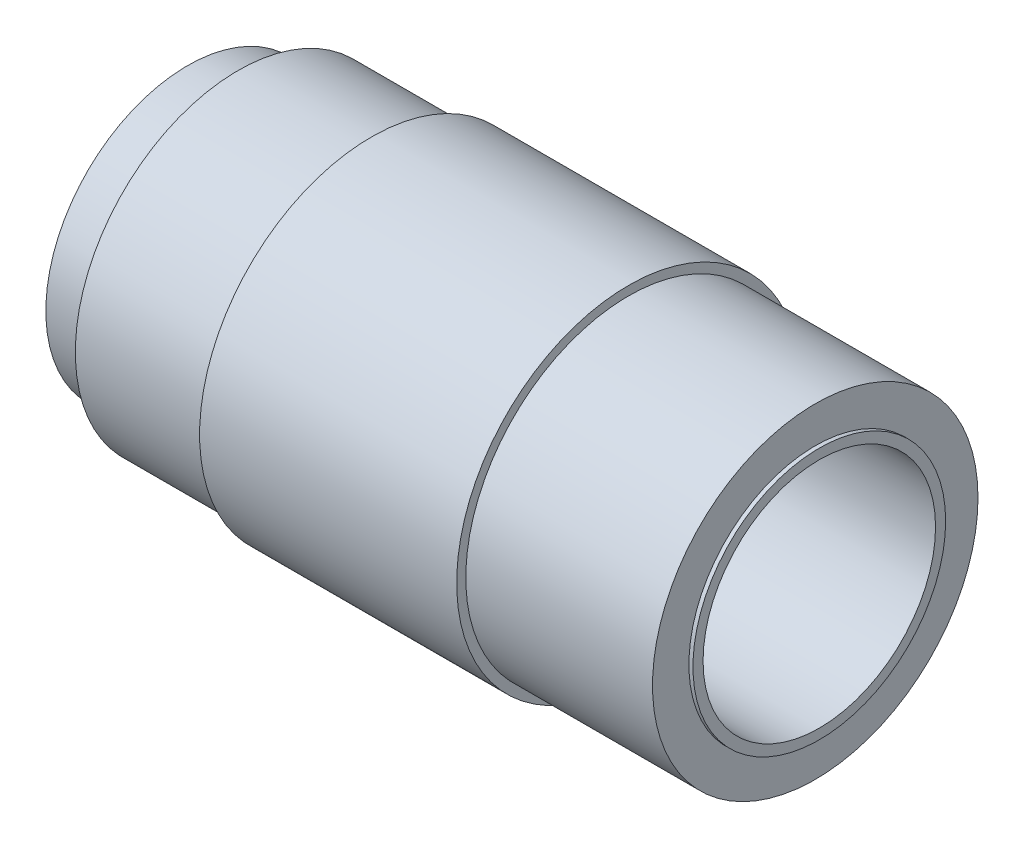
from build123d import *


with BuildPart() as part:
    # Sketch1 → Revolve1 (revolve)
    with BuildSketch(Plane(origin=(0, 0, 0), x_dir=(1, 0, 0), z_dir=(0, 1, 0))):
        Polygon((-37.5, 12.5), (-37.5, 11.5), (-100, 11.5), (-100, 14.01764351), (-95, 14.01764351), (-95, 16.1), (-81.808468411, 16.1), (-81.808468411, 17), (-56.373432924, 17), (-56.373432924, 16.1), (-37.9, 16.1), (-37.9, 12.5), align=None)
    revolve(axis=Axis((0, 0, 0), (-1, 0, 0)))


solid = part.part
